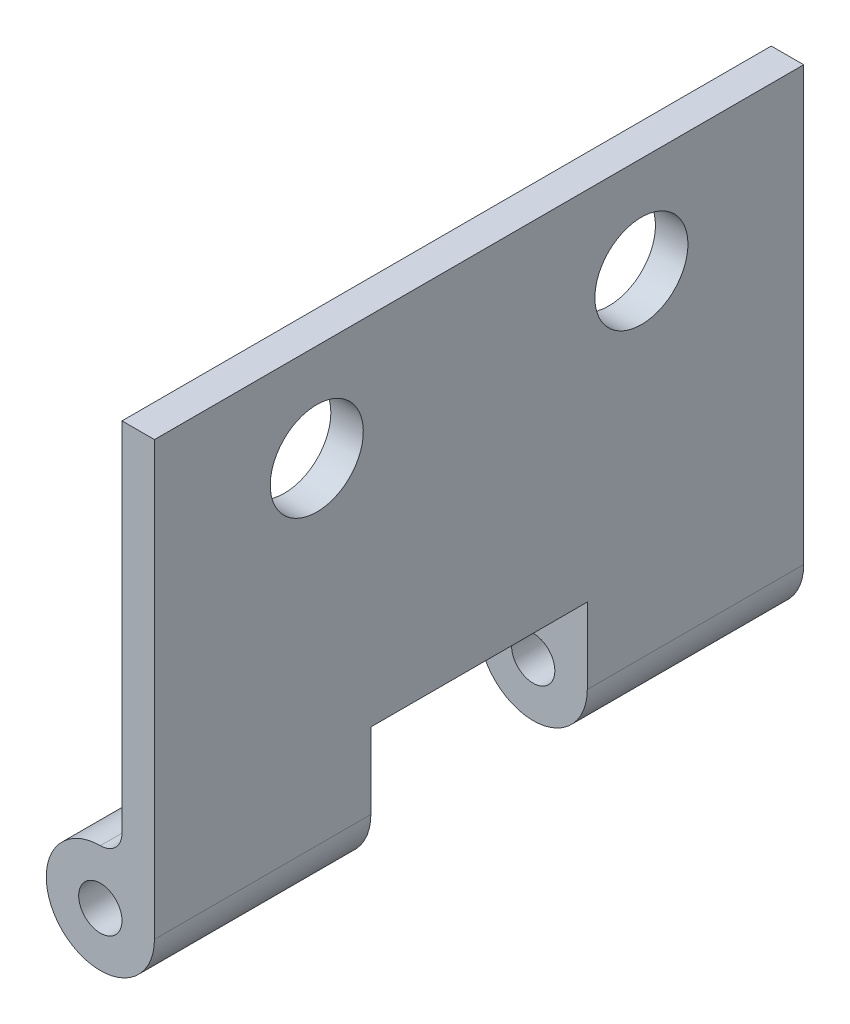
from build123d import *

# Parameters (mm, degrees)
SKETCH2_R               = 1
BOSS_EXTRUDE2_DEPTH     = 30
CUT_EXTRUDE1_DEPTH      = 37.224991373
CUT_EXTRUDE1_DEPTH_BACK = 37.224991373
SKETCH3_R               = 2.15
SKETCH3_W               = 10
SKETCH3_H               = 7


with BuildPart() as part:
    # Sketch2 → Boss-Extrude2 (new body)
    with BuildSketch(Plane.XY):
        with BuildLine():
            Line((1, 3.5), (1, 20))
            Line((1, 20), (2.5, 20))
            Line((2.5, 20), (2.5, 0))
            ThreePointArc((2.5, 0), (-1.767766953, -1.767766953), (0, 2.5))
            ThreePointArc((0, 2.5), (0.707106781, 2.792893219), (1, 3.5))
        make_face()
        Circle(SKETCH2_R, mode=Mode.SUBTRACT)
    extrude(amount=BOSS_EXTRUDE2_DEPTH)

    # Sketch3 → Cut-Extrude1 (cut, two sides: drawn at the far end of the back side and taken through both)
    with BuildSketch(Plane.ZY.offset(-1).offset(-CUT_EXTRUDE1_DEPTH_BACK)):
        with Locations(Location((7.5, 15.5, 0), (0, 0, 270))):
            Circle(SKETCH3_R)
        with Locations(Location((22.5, 15.5, 0), (0, 0, 270))):
            Circle(SKETCH3_R)
        with Locations((15, 0)):
            Rectangle(SKETCH3_W, SKETCH3_H)
    extrude(amount=CUT_EXTRUDE1_DEPTH + CUT_EXTRUDE1_DEPTH_BACK, mode=Mode.SUBTRACT)


solid = part.part
